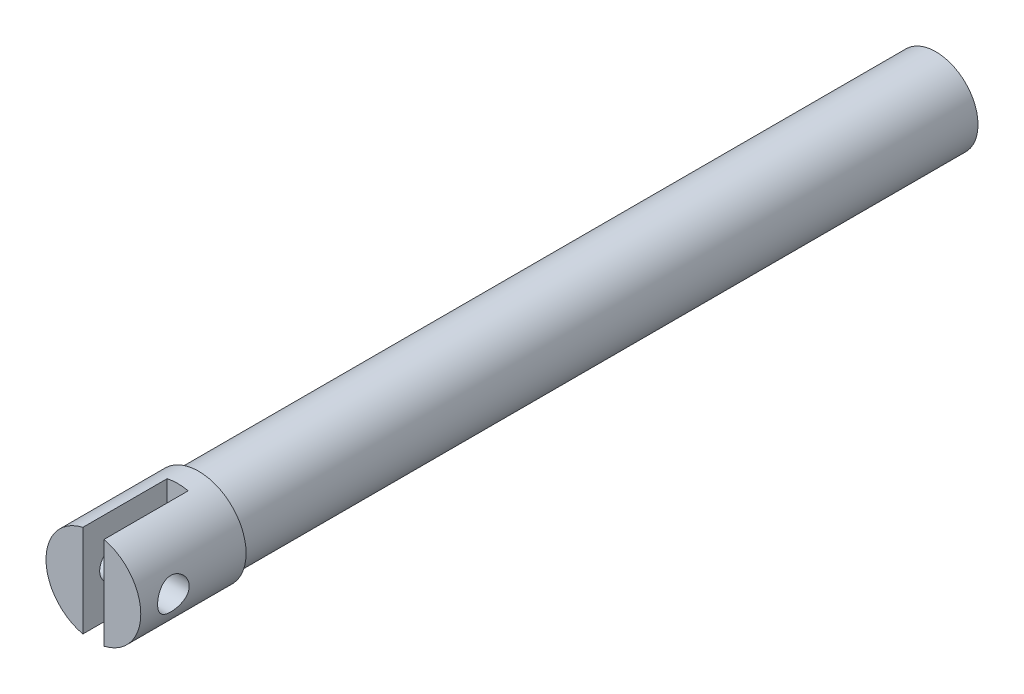
from build123d import *

# Parameters (mm, degrees)
SKETCH1_R               = 4
BOSS_EXTRUDE1_DEPTH     = 80
SKETCH2_R               = 4.5
BOSS_EXTRUDE2_DEPTH     = 10
SKETCH2_3_W             = 2
SKETCH2_3_H             = 11.355365006
CUT_EXTRUDE2_DEPTH      = 8
CUT_EXTRUDE3_DEPTH      = 81.25272581
CUT_EXTRUDE3_DEPTH_BACK = 81.25272581
SKETCH3_R               = 1.5


with BuildPart() as part:
    # Sketch1 → Boss-Extrude1 (new body)
    with BuildSketch(Plane.XY):
        Circle(SKETCH1_R)
    extrude(amount=BOSS_EXTRUDE1_DEPTH)

    # Sketch2 → Boss-Extrude2 (add)
    with BuildSketch(Plane.XY.offset(80)):
        Circle(SKETCH2_R)
    extrude(amount=-BOSS_EXTRUDE2_DEPTH)

    # Sketch2<3> → Cut-Extrude2 (cut)
    with BuildSketch(Plane.XY.offset(80)):
        Rectangle(SKETCH2_3_W, SKETCH2_3_H)
    extrude(amount=-CUT_EXTRUDE2_DEPTH, mode=Mode.SUBTRACT)

    # Sketch3 → Cut-Extrude3 (cut, two sides: drawn at the far end of the back side and taken through both)
    with BuildSketch(Plane(origin=(0, 0, 0), x_dir=(0, 0, -1), z_dir=(1, 0, 0)).offset(-CUT_EXTRUDE3_DEPTH_BACK)):
        with Locations((-76.901418772, 0)):
            Circle(SKETCH3_R)
    extrude(amount=CUT_EXTRUDE3_DEPTH + CUT_EXTRUDE3_DEPTH_BACK, mode=Mode.SUBTRACT)


solid = part.part
